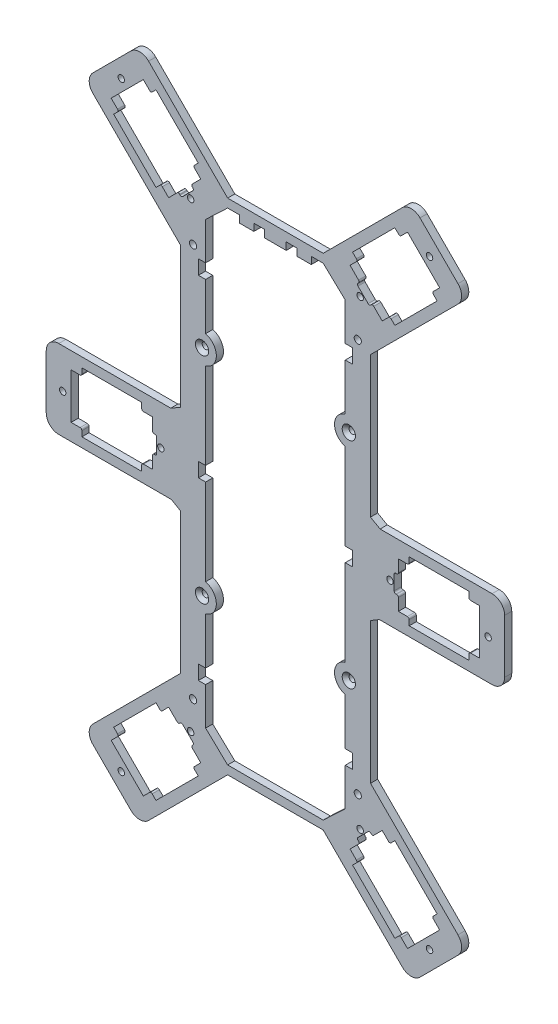
from build123d import *

# Parameters (mm, degrees)
SKETCH_1_R                = 0.9
SKETCH_1_R_2              = 0.8
SKETCH_1_R_3              = 1
EXTRUDE_1_DEPTH           = 2
FILLET_1_R                = 3.5
HOLE_WIZARD_1_D           = 1.8
HOLE_WIZARD_1_DEPTH       = 3.65
HOLE_WIZARD_1_CSINK_D     = 3.7
HOLE_WIZARD_1_CSINK_ANGLE = 90
HOLE_WIZARD_1_TIP         = 0.540774557


with BuildPart() as part:
    # 草图1 → 凸台-拉伸1 (new body)
    with BuildSketch(Plane.XY):
        Polygon((-26.556292716, 51.843156425), (-26.556292716, 12.544385477), (-29.229747363, 11), (-64.005429013, 11), (-64.005429013, -11), (-29.033083059, -11), (-26.556292716, -12.466523206), (-26.556292716, -51.843156425), (-53.451522535, -78.738386244), (-37.895173349, -94.29473543), (-13.343143743, -69.742705824), (13.343143743, -69.742705824), (37.895173349, -94.29473543), (53.451522535, -78.738386244), (26.556292716, -51.843156425), (26.556292716, -12.466523206), (29.033083059, -11), (64.005429013, -11), (64.005429013, 11), (29.229747363, 11), (26.556292716, 12.544385477), (26.556292716, 51.843156425), (53.451522535, 78.738386244), (37.895173349, 94.29473543), (13.343143743, 69.742705824), (-13.343143743, 69.742705824), (-37.895173349, 94.29473543), (-53.451522535, 78.738386244), align=None)
        with Locations((32.002714507, 0)):
            Circle(SKETCH_1_R, mode=Mode.SUBTRACT)
        with Locations((59.402714507, 0)):
            Circle(SKETCH_1_R, mode=Mode.SUBTRACT)
        with Locations(Location((43.042511841, -83.809543319, 0), (0, 0, 180))):
            Circle(SKETCH_1_R, mode=Mode.SUBTRACT)
        with Locations(Location((23.667786036, -64.434817515, 0), (0, 0, 180))):
            Circle(SKETCH_1_R, mode=Mode.SUBTRACT)
        with Locations((-23.667786036, -64.434817515)):
            Circle(SKETCH_1_R, mode=Mode.SUBTRACT)
        with Locations((-20.5, -30)):
            Circle(SKETCH_1_R_2, mode=Mode.SUBTRACT)
        with Locations((20.5, -30)):
            Circle(SKETCH_1_R_2, mode=Mode.SUBTRACT)
        with Locations((-20.5, 30)):
            Circle(SKETCH_1_R_2, mode=Mode.SUBTRACT)
        with Locations((20.5, 30)):
            Circle(SKETCH_1_R_2, mode=Mode.SUBTRACT)
        with Locations((-23, 53.666516131)):
            Circle(SKETCH_1_R_3, mode=Mode.SUBTRACT)
        with Locations((23, 53.666516131)):
            Circle(SKETCH_1_R_3, mode=Mode.SUBTRACT)
        with Locations((-23, -56.267593402)):
            Circle(SKETCH_1_R_3, mode=Mode.SUBTRACT)
        with Locations((23, -56.267593402)):
            Circle(SKETCH_1_R_3, mode=Mode.SUBTRACT)
        with Locations(Location((-43.042511841, 83.809543319, 0), (0, 0, 180))):
            Circle(SKETCH_1_R, mode=Mode.SUBTRACT)
        with Locations(Location((-59.402714507, 0, 0), (0, 0, 180))):
            Circle(SKETCH_1_R, mode=Mode.SUBTRACT)
        with Locations(Location((-32.002714507, 0, 0), (0, 0, 180))):
            Circle(SKETCH_1_R, mode=Mode.SUBTRACT)
        with Locations(Location((-23.667786036, 64.434817515, 0), (0, 0, 180))):
            Circle(SKETCH_1_R, mode=Mode.SUBTRACT)
        with Locations((23.667786036, 64.434817515)):
            Circle(SKETCH_1_R, mode=Mode.SUBTRACT)
        with Locations((43.042511841, 83.809543319)):
            Circle(SKETCH_1_R, mode=Mode.SUBTRACT)
        with Locations((-43.042511841, -83.809543319)):
            Circle(SKETCH_1_R, mode=Mode.SUBTRACT)
        with BuildLine():
            Line((-33.15271453, 2.000000006), (-33.15271453, -1.999999994))
            ThreePointArc((-33.15271453, -1.999999994), (-33.299161138, -2.353553382), (-33.652714526, -2.49999999))
            Line((-33.652714526, -2.49999999), (-33.852714526, -2.49999999))
            ThreePointArc((-33.852714526, -2.49999999), (-34.206267919, -2.646446601), (-34.35271453, -2.999999994))
            Line((-34.35271453, -2.999999994), (-34.35271453, -6.350000005))
            Line((-34.35271453, -6.350000005), (-36.852714518, -6.350000005))
            ThreePointArc((-36.852714518, -6.350000005), (-37.206267905, -6.496446613), (-37.352714513, -6.85))
            Line((-37.352714513, -6.85), (-37.352714513, -8.350000008))
            Line((-37.352714513, -8.350000008), (-54.052714512, -8.350000008))
            Line((-54.052714512, -8.350000008), (-54.052714512, -6.850000005))
            ThreePointArc((-54.052714512, -6.850000005), (-54.19916112, -6.496446618), (-54.552714507, -6.35000001))
            Line((-54.552714507, -6.35000001), (-57.052714488, -6.35000001))
            Line((-57.052714488, -6.35000001), (-57.052714488, 6.350000013))
            Line((-57.052714488, 6.350000013), (-54.552714507, 6.350000013))
            ThreePointArc((-54.552714507, 6.350000013), (-54.19916112, 6.496446621), (-54.052714512, 6.850000008))
            Line((-54.052714512, 6.850000008), (-54.052714512, 8.350000017))
            Line((-54.052714512, 8.350000017), (-37.352714515, 8.350000017))
            Line((-37.352714515, 8.350000017), (-37.352714515, 6.850000014))
            ThreePointArc((-37.352714515, 6.850000014), (-37.206267907, 6.496446627), (-36.85271452, 6.350000019))
            Line((-36.85271452, 6.350000019), (-34.35271453, 6.350000019))
            Line((-34.35271453, 6.350000019), (-34.35271453, 3.000000005))
            ThreePointArc((-34.35271453, 3.000000005), (-34.206267919, 2.646446612), (-33.852714526, 2.500000001))
            Line((-33.852714526, 2.500000001), (-33.652714526, 2.500000001))
            ThreePointArc((-33.652714526, 2.500000001), (-33.299161138, 2.353553393), (-33.15271453, 2.000000006))
        make_face(mode=Mode.SUBTRACT)
        with BuildLine():
            Line((-32.294488771, 63.374157348), (-33.355148949, 62.31349717))
            Line((-33.355148949, 62.31349717), (-45.163832194, 74.122180414))
            Line((-45.163832194, 74.122180414), (-44.10317202, 75.182840589))
            ThreePointArc((-44.10317202, 75.182840589), (-43.956725412, 75.536393976), (-44.10317202, 75.889947363))
            Line((-44.10317202, 75.889947363), (-45.870938959, 77.657714302))
            Line((-45.870938959, 77.657714302), (-36.890682822, 86.63797044))
            Line((-36.890682822, 86.63797044), (-35.122915882, 84.8702035))
            ThreePointArc((-35.122915882, 84.8702035), (-34.769362495, 84.723756892), (-34.415809108, 84.8702035))
            Line((-34.415809108, 84.8702035), (-33.35514893, 85.930863678))
            Line((-33.35514893, 85.930863678), (-21.546465686, 74.122180435))
            Line((-21.546465686, 74.122180435), (-22.607125861, 73.06152026))
            ThreePointArc((-22.607125861, 73.06152026), (-22.753572468, 72.707966873), (-22.607125861, 72.354413486))
            Line((-22.607125861, 72.354413486), (-20.839358915, 70.586646541))
            Line((-20.839358915, 70.586646541), (-23.208166641, 68.217838814))
            ThreePointArc((-23.208166641, 68.217838814), (-23.354613252, 67.864285421), (-23.208166641, 67.510732028))
            Line((-23.208166641, 67.510732028), (-23.066745285, 67.369310671))
            ThreePointArc((-23.066745285, 67.369310671), (-22.920298677, 67.015757284), (-23.066745285, 66.662203896))
            Line((-23.066745285, 66.662203896), (-25.89517241, 63.833776771))
            ThreePointArc((-25.89517241, 63.833776771), (-26.248725797, 63.687330163), (-26.602279185, 63.833776771))
            Line((-26.602279185, 63.833776771), (-26.743700541, 63.975198127))
            ThreePointArc((-26.743700541, 63.975198127), (-27.097253935, 64.121644738), (-27.450807328, 63.975198127))
            Line((-27.450807328, 63.975198127), (-29.819615052, 61.606390403))
            Line((-29.819615052, 61.606390403), (-31.587381997, 63.374157348))
            ThreePointArc((-31.587381997, 63.374157348), (-31.940935384, 63.520603956), (-32.294488771, 63.374157348))
        make_face(mode=Mode.SUBTRACT)
        with BuildLine():
            Line((-23.208166641, -67.510732028), (-23.066745285, -67.369310671))
            ThreePointArc((-23.066745285, -67.369310671), (-22.920298677, -67.015757284), (-23.066745285, -66.662203896))
            Line((-23.066745285, -66.662203896), (-25.89517241, -63.833776771))
            ThreePointArc((-25.89517241, -63.833776771), (-26.248725797, -63.687330163), (-26.602279185, -63.833776771))
            Line((-26.602279185, -63.833776771), (-26.743700541, -63.975198127))
            ThreePointArc((-26.743700541, -63.975198127), (-27.097253935, -64.121644738), (-27.450807328, -63.975198127))
            Line((-27.450807328, -63.975198127), (-29.819615052, -61.606390403))
            Line((-29.819615052, -61.606390403), (-31.587381997, -63.374157348))
            ThreePointArc((-31.587381997, -63.374157348), (-31.940935384, -63.520603956), (-32.294488771, -63.374157348))
            Line((-32.294488771, -63.374157348), (-33.355148949, -62.31349717))
            Line((-33.355148949, -62.31349717), (-45.163832194, -74.122180414))
            Line((-45.163832194, -74.122180414), (-44.10317202, -75.182840589))
            ThreePointArc((-44.10317202, -75.182840589), (-43.956725412, -75.536393976), (-44.10317202, -75.889947363))
            Line((-44.10317202, -75.889947363), (-45.870938959, -77.657714302))
            Line((-45.870938959, -77.657714302), (-36.890682822, -86.63797044))
            Line((-36.890682822, -86.63797044), (-35.122915882, -84.8702035))
            ThreePointArc((-35.122915882, -84.8702035), (-34.769362495, -84.723756892), (-34.415809108, -84.8702035))
            Line((-34.415809108, -84.8702035), (-33.35514893, -85.930863678))
            Line((-33.35514893, -85.930863678), (-21.546465686, -74.122180435))
            Line((-21.546465686, -74.122180435), (-22.607125861, -73.06152026))
            ThreePointArc((-22.607125861, -73.06152026), (-22.753572468, -72.707966873), (-22.607125861, -72.354413486))
            Line((-22.607125861, -72.354413486), (-20.839358915, -70.586646541))
            Line((-20.839358915, -70.586646541), (-23.208166641, -68.217838814))
            ThreePointArc((-23.208166641, -68.217838814), (-23.354613252, -67.864285421), (-23.208166641, -67.510732028))
        make_face(mode=Mode.SUBTRACT)
        with BuildLine():
            Line((33.35514893, -85.930863678), (21.546465686, -74.122180435))
            Line((21.546465686, -74.122180435), (22.607125861, -73.06152026))
            ThreePointArc((22.607125861, -73.06152026), (22.753572468, -72.707966873), (22.607125861, -72.354413486))
            Line((22.607125861, -72.354413486), (20.839358915, -70.586646541))
            Line((20.839358915, -70.586646541), (23.208166641, -68.217838814))
            ThreePointArc((23.208166641, -68.217838814), (23.354613252, -67.864285421), (23.208166641, -67.510732028))
            Line((23.208166641, -67.510732028), (23.066745285, -67.369310671))
            ThreePointArc((23.066745285, -67.369310671), (22.920298677, -67.015757284), (23.066745285, -66.662203896))
            Line((23.066745285, -66.662203896), (25.89517241, -63.833776771))
            ThreePointArc((25.89517241, -63.833776771), (26.248725797, -63.687330163), (26.602279185, -63.833776771))
            Line((26.602279185, -63.833776771), (26.743700541, -63.975198127))
            ThreePointArc((26.743700541, -63.975198127), (27.097253935, -64.121644738), (27.450807328, -63.975198127))
            Line((27.450807328, -63.975198127), (29.819615052, -61.606390403))
            Line((29.819615052, -61.606390403), (31.587381997, -63.374157348))
            ThreePointArc((31.587381997, -63.374157348), (31.940935384, -63.520603956), (32.294488771, -63.374157348))
            Line((32.294488771, -63.374157348), (33.355148949, -62.31349717))
            Line((33.355148949, -62.31349717), (45.163832194, -74.122180414))
            Line((45.163832194, -74.122180414), (44.10317202, -75.182840589))
            ThreePointArc((44.10317202, -75.182840589), (43.956725412, -75.536393976), (44.10317202, -75.889947363))
            Line((44.10317202, -75.889947363), (45.870938959, -77.657714302))
            Line((45.870938959, -77.657714302), (36.890682822, -86.63797044))
            Line((36.890682822, -86.63797044), (35.122915882, -84.8702035))
            ThreePointArc((35.122915882, -84.8702035), (34.769362495, -84.723756892), (34.415809108, -84.8702035))
            Line((34.415809108, -84.8702035), (33.35514893, -85.930863678))
        make_face(mode=Mode.SUBTRACT)
        with BuildLine():
            Line((-13.343164006, -67.343147906), (13.343164006, -67.343147906))
            Line((13.343164006, -67.343147906), (19.5, -61.516177872))
            Line((19.5, -61.516177872), (19.5, -51.000001572))
            Line((19.5, -51.000001572), (21.499999799, -51.000001572))
            Line((21.499999799, -51.000001572), (21.499999799, -47))
            Line((21.499999799, -47), (19.5, -47))
            Line((19.5, -47), (19.5, -33.872983346))
            ThreePointArc((19.5, -33.872983346), (16.5, -30), (19.5, -26.127016654))
            Line((19.5, -26.127016654), (19.5, -2.000000328))
            Line((19.5, -2.000000328), (21.499999799, -2.000000328))
            Line((21.499999799, -2.000000328), (21.499999799, 2.000000328))
            Line((21.499999799, 2.000000328), (19.5, 2.000000328))
            Line((19.5, 2.000000328), (19.5, 26.127016654))
            ThreePointArc((19.5, 26.127016654), (16.5, 30), (19.5, 33.872983346))
            Line((19.5, 33.872983346), (19.5, 47))
            Line((19.5, 47), (21.499999799, 47))
            Line((21.499999799, 47), (21.499999799, 51.000001572))
            Line((21.499999799, 51.000001572), (19.5, 51.000001572))
            Line((19.5, 51.000001572), (19.5, 61.516177872))
            Line((19.5, 61.516177872), (13.343164006, 67.343147906))
            Line((13.343164006, 67.343147906), (10.015, 67.343147907))
            Line((10.015, 67.343147907), (10.015, 65.343147907))
            Line((10.015, 65.343147907), (6.015, 65.343147907))
            Line((6.015, 65.343147907), (6.015, 67.343147907))
            Line((6.015, 67.343147907), (3.015, 67.343147907))
            Line((3.015, 67.343147907), (3.015, 65.26698383))
            Line((3.015, 65.26698383), (-3.015, 65.26698383))
            Line((-3.015, 65.26698383), (-3.015, 67.343147907))
            Line((-3.015, 67.343147907), (-6.015, 67.343147907))
            Line((-6.015, 67.343147907), (-6.015, 65.343147907))
            Line((-6.015, 65.343147907), (-10.015, 65.343147907))
            Line((-10.015, 65.343147907), (-10.015, 67.343147907))
            Line((-10.015, 67.343147907), (-13.343164006, 67.343147906))
            Line((-13.343164006, 67.343147906), (-19.5, 61.516175426))
            Line((-19.5, 61.516175426), (-19.5, 51.000001572))
            Line((-19.5, 51.000001572), (-21.499999799, 51.000001572))
            Line((-21.499999799, 51.000001572), (-21.499999799, 47))
            Line((-21.499999799, 47), (-19.5, 47))
            Line((-19.5, 47), (-19.5, 33.872983346))
            ThreePointArc((-19.5, 33.872983346), (-16.5, 30), (-19.5, 26.127016654))
            Line((-19.5, 26.127016654), (-19.5, 2.000000328))
            Line((-19.5, 2.000000328), (-21.499999799, 2.000000328))
            Line((-21.499999799, 2.000000328), (-21.499999799, -2.000000328))
            Line((-21.499999799, -2.000000328), (-19.5, -2.000000328))
            Line((-19.5, -2.000000328), (-19.5, -26.127016654))
            ThreePointArc((-19.5, -26.127016654), (-16.5, -30), (-19.5, -33.872983346))
            Line((-19.5, -33.872983346), (-19.5, -47))
            Line((-19.5, -47), (-21.499999799, -47))
            Line((-21.499999799, -47), (-21.499999799, -51.000001572))
            Line((-21.499999799, -51.000001572), (-19.5, -51.000001572))
            Line((-19.5, -51.000001572), (-19.5, -61.516175426))
            Line((-19.5, -61.516175426), (-13.343164006, -67.343147906))
        make_face(mode=Mode.SUBTRACT)
        with BuildLine():
            Line((23.208166641, 67.510732028), (23.066745285, 67.369310671))
            ThreePointArc((23.066745285, 67.369310671), (22.920298677, 67.015757284), (23.066745285, 66.662203896))
            Line((23.066745285, 66.662203896), (25.89517241, 63.833776771))
            ThreePointArc((25.89517241, 63.833776771), (26.248725797, 63.687330163), (26.602279185, 63.833776771))
            Line((26.602279185, 63.833776771), (26.743700541, 63.975198127))
            ThreePointArc((26.743700541, 63.975198127), (27.097253935, 64.121644738), (27.450807328, 63.975198127))
            Line((27.450807328, 63.975198127), (29.819615052, 61.606390403))
            Line((29.819615052, 61.606390403), (31.587381997, 63.374157348))
            ThreePointArc((31.587381997, 63.374157348), (31.940935384, 63.520603956), (32.294488771, 63.374157348))
            Line((32.294488771, 63.374157348), (33.355148949, 62.31349717))
            Line((33.355148949, 62.31349717), (45.163832194, 74.122180414))
            Line((45.163832194, 74.122180414), (44.10317202, 75.182840589))
            ThreePointArc((44.10317202, 75.182840589), (43.956725412, 75.536393976), (44.10317202, 75.889947363))
            Line((44.10317202, 75.889947363), (45.870938959, 77.657714302))
            Line((45.870938959, 77.657714302), (36.890682822, 86.63797044))
            Line((36.890682822, 86.63797044), (35.122915882, 84.8702035))
            ThreePointArc((35.122915882, 84.8702035), (34.769362495, 84.723756892), (34.415809108, 84.8702035))
            Line((34.415809108, 84.8702035), (33.35514893, 85.930863678))
            Line((33.35514893, 85.930863678), (21.546465686, 74.122180435))
            Line((21.546465686, 74.122180435), (22.607125861, 73.06152026))
            ThreePointArc((22.607125861, 73.06152026), (22.753572468, 72.707966873), (22.607125861, 72.354413486))
            Line((22.607125861, 72.354413486), (20.839358915, 70.586646541))
            Line((20.839358915, 70.586646541), (23.208166641, 68.217838814))
            ThreePointArc((23.208166641, 68.217838814), (23.354613252, 67.864285421), (23.208166641, 67.510732028))
        make_face(mode=Mode.SUBTRACT)
        with BuildLine():
            Line((33.852714526, 2.500000001), (33.652714526, 2.500000001))
            ThreePointArc((33.652714526, 2.500000001), (33.299161138, 2.353553393), (33.15271453, 2.000000006))
            Line((33.15271453, 2.000000006), (33.15271453, -1.999999994))
            ThreePointArc((33.15271453, -1.999999994), (33.299161138, -2.353553382), (33.652714526, -2.49999999))
            Line((33.652714526, -2.49999999), (33.852714526, -2.49999999))
            ThreePointArc((33.852714526, -2.49999999), (34.206267919, -2.646446601), (34.35271453, -2.999999994))
            Line((34.35271453, -2.999999994), (34.35271453, -6.350000005))
            Line((34.35271453, -6.350000005), (36.852714518, -6.350000005))
            ThreePointArc((36.852714518, -6.350000005), (37.206267905, -6.496446613), (37.352714513, -6.85))
            Line((37.352714513, -6.85), (37.352714513, -8.350000008))
            Line((37.352714513, -8.350000008), (54.052714512, -8.350000008))
            Line((54.052714512, -8.350000008), (54.052714512, -6.850000005))
            ThreePointArc((54.052714512, -6.850000005), (54.19916112, -6.496446618), (54.552714507, -6.35000001))
            Line((54.552714507, -6.35000001), (57.052714488, -6.35000001))
            Line((57.052714488, -6.35000001), (57.052714488, 6.350000013))
            Line((57.052714488, 6.350000013), (54.552714507, 6.350000013))
            ThreePointArc((54.552714507, 6.350000013), (54.19916112, 6.496446621), (54.052714512, 6.850000008))
            Line((54.052714512, 6.850000008), (54.052714512, 8.350000017))
            Line((54.052714512, 8.350000017), (37.352714515, 8.350000017))
            Line((37.352714515, 8.350000017), (37.352714515, 6.850000014))
            ThreePointArc((37.352714515, 6.850000014), (37.206267907, 6.496446627), (36.85271452, 6.350000019))
            Line((36.85271452, 6.350000019), (34.35271453, 6.350000019))
            Line((34.35271453, 6.350000019), (34.35271453, 3.000000005))
            ThreePointArc((34.35271453, 3.000000005), (34.206267919, 2.646446612), (33.852714526, 2.500000001))
        make_face(mode=Mode.SUBTRACT)
    extrude(amount=EXTRUDE_1_DEPTH)

    # 圆角1
    fillet_1_edges = [part.edges().sort_by_distance(p)[0] for p in [
        (37.895173349, 94.29473543, 1),
        (53.451522535, 78.738386244, 1),
        (64.005429013, 11, 1),
        (64.005429013, -11, 1),
        (53.451522535, -78.738386244, 1),
        (37.895173349, -94.29473543, 1),
        (-37.895173349, -94.29473543, 1),
        (-53.451522535, -78.738386244, 1),
        (-64.005429013, -11, 1),
        (-64.005429013, 11, 1),
        (-53.451522535, 78.738386244, 1),
        (-37.895173349, 94.29473543, 1),
    ]]
    fillet(fillet_1_edges, radius=FILLET_1_R)

    # 打孔尺寸开槽半沉头螺钉的类型1
    with Locations(Plane.XY.offset(2)):
        with Locations((-20.5, 30), (20.5, 30), (-20.5, -30), (20.5, -30)):
            CounterSinkHole(HOLE_WIZARD_1_D / 2, HOLE_WIZARD_1_CSINK_D / 2, depth=HOLE_WIZARD_1_DEPTH, counter_sink_angle=HOLE_WIZARD_1_CSINK_ANGLE)
            with Locations((0, 0, -(HOLE_WIZARD_1_DEPTH + HOLE_WIZARD_1_TIP / 2))):  # 118° drill point
                Cone(0, HOLE_WIZARD_1_D / 2, HOLE_WIZARD_1_TIP, mode=Mode.SUBTRACT)


solid = part.part
